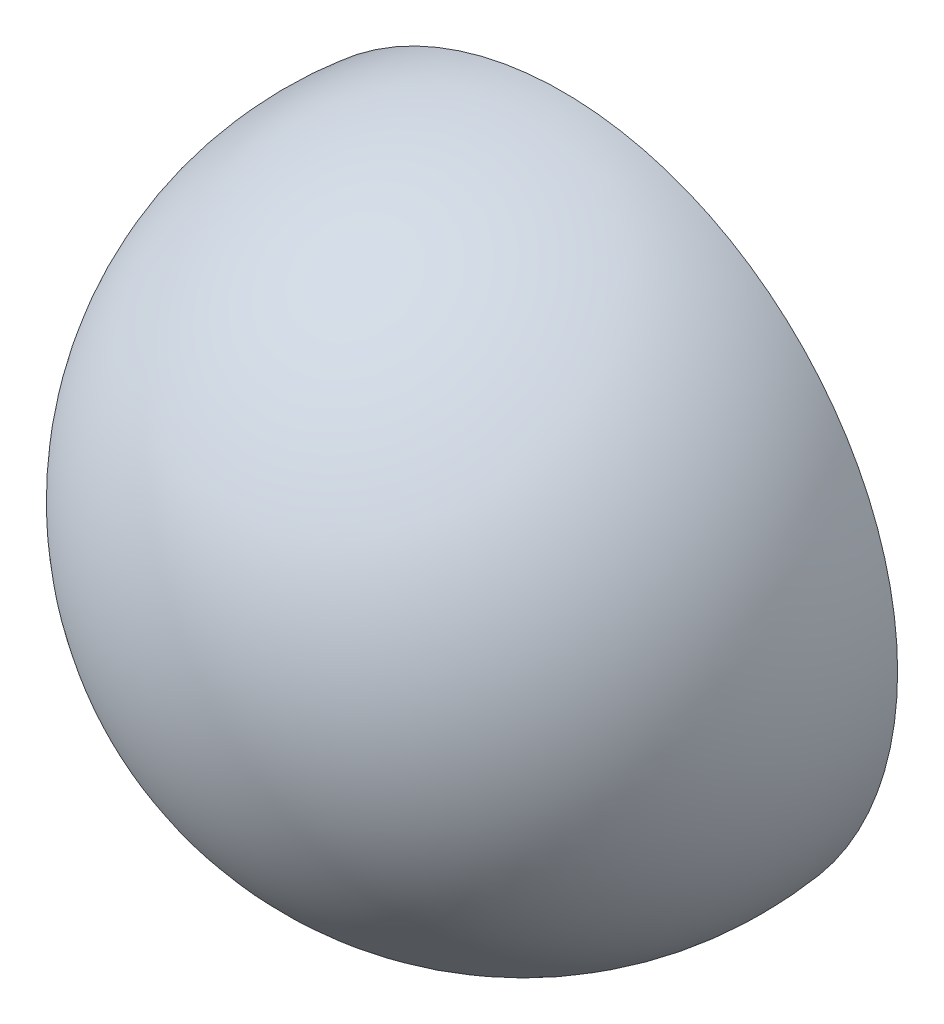
from build123d import *


with BuildPart() as part:
    # Эскиз1 → Повернуть1 (revolve)
    with BuildSketch(Plane(origin=(0, 0, 0), x_dir=(1, 0, 0), z_dir=(0, 1, 0))):
        with BuildLine():
            Line((0, 0), (0, -4.5))
            ThreePointArc((0, -4.5), (-3.010398645, -3.148132129), (-4, 0))
            Line((-4, 0), (0, 0))
        make_face()
    revolve(axis=Axis((0, 0, 0), (0, 0, 1)))


solid = part.part
